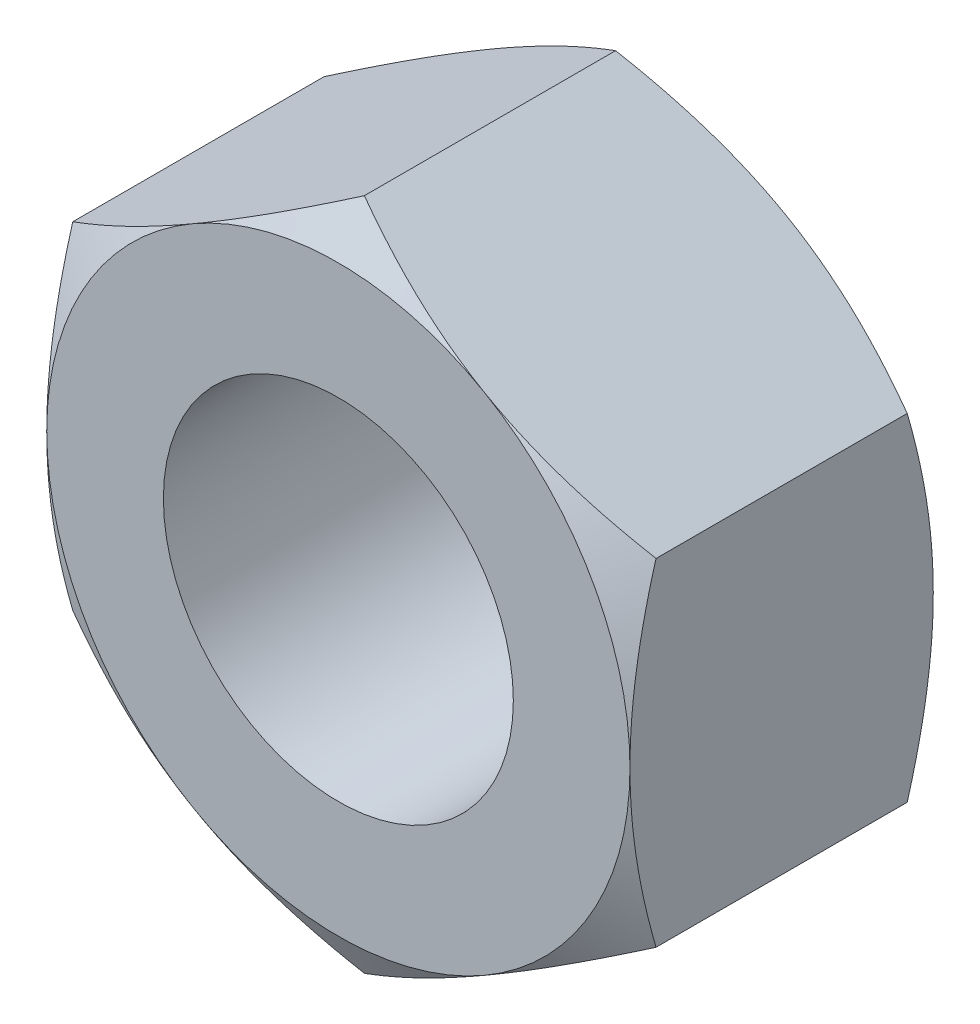
from build123d import *

# Parameters (mm, degrees)
BOSS_EXTRUDE1_DEPTH      = 2.6
BOSS_EXTRUDE1_DEPTH_BACK = 2.6
SKETCH2_R                = 3
SKETCH3_OUTSIDE_W        = 50.698
SKETCH3_OUTSIDE_H        = 52.246
SKETCH3_OUTSIDE_R        = 5
CUT_EXTRUDE1_DEPTH       = 10.239769117
CUT_EXTRUDE1_DRAFT       = -60
MIRROR1_COPY_1_SKETCH_W  = 50.698
MIRROR1_COPY_1_SKETCH_H  = 52.246
MIRROR1_COPY_1_SKETCH_R  = 5
MIRROR1_COPY_1_DEPTH     = 10.239769117
MIRROR1_COPY_1_DRAFT     = -60


with BuildPart() as part:
    # Sketch2 → Boss-Extrude1 (new, two sides: drawn at the far end of the back side and taken through both)
    with BuildSketch(Plane.XY.offset(-BOSS_EXTRUDE1_DEPTH_BACK)):
        Polygon((0, 5.773502692), (-5, 2.886751346), (-5, -2.886751346), (0, -5.773502692), (5, -2.886751346), (5, 2.886751346), align=None)
        Circle(SKETCH2_R, mode=Mode.SUBTRACT)
    extrude(amount=BOSS_EXTRUDE1_DEPTH + BOSS_EXTRUDE1_DEPTH_BACK)


with BuildPart() as cut_extrude1_tool:
    # Sketch3 outside → Cut-Extrude1 (with draft: the straight prism first)
    with BuildSketch(Plane.XY.offset(2.6)):
        Rectangle(SKETCH3_OUTSIDE_W, SKETCH3_OUTSIDE_H)
        Circle(SKETCH3_OUTSIDE_R, mode=Mode.SUBTRACT)
    extrude(amount=-CUT_EXTRUDE1_DEPTH)
    # Cut-Extrude1: the draft: its side faces are tilted about the plane it starts from
    cut_extrude1_sides = [cut_extrude1_tool.faces().sort_by_distance(p)[0] for p in [
        (0, -26.123, -2.519884558),
        (25.349, 0, -2.519884558),
        (0, 26.123, -2.519884558),
        (-25.349, 0, -2.519884558),
        (-5, 0, -2.519884558),
    ]]
    draft(cut_extrude1_sides, Plane.XY.offset(2.6), CUT_EXTRUDE1_DRAFT)


with BuildPart() as part_1:
    add(part.part)

    # Cut-Extrude1: cut by cut_extrude1_tool
    add(cut_extrude1_tool.part, mode=Mode.SUBTRACT)


with BuildPart() as mirror1_copy_1_tool:
    # Mirror1 copy 1 sketch → Mirror1 copy 1 (with draft: the straight prism first)
    with BuildSketch(Plane(origin=(0, 0, -2.6), x_dir=(1, 0, 0), z_dir=(0, 0, -1))):
        Rectangle(MIRROR1_COPY_1_SKETCH_W, MIRROR1_COPY_1_SKETCH_H)
        Circle(MIRROR1_COPY_1_SKETCH_R, mode=Mode.SUBTRACT)
    extrude(amount=-MIRROR1_COPY_1_DEPTH)
    # Mirror1 copy 1: the draft: its side faces are tilted about the plane it starts from
    mirror1_copy_1_sides = [mirror1_copy_1_tool.faces().sort_by_distance(p)[0] for p in [
        (0, -26.123, 2.519884558),
        (25.349, 0, 2.519884558),
        (0, 26.123, 2.519884558),
        (-25.349, 0, 2.519884558),
        (-5, 0, 2.519884558),
    ]]
    draft(mirror1_copy_1_sides, Plane(origin=(0, 0, -2.6), x_dir=(1, 0, 0), z_dir=(0, 0, -1)), MIRROR1_COPY_1_DRAFT)


with BuildPart() as part_2:
    add(part_1.part)

    # Mirror1 copy 1: cut by mirror1_copy_1_tool
    add(mirror1_copy_1_tool.part, mode=Mode.SUBTRACT)


solid = part_2.part
